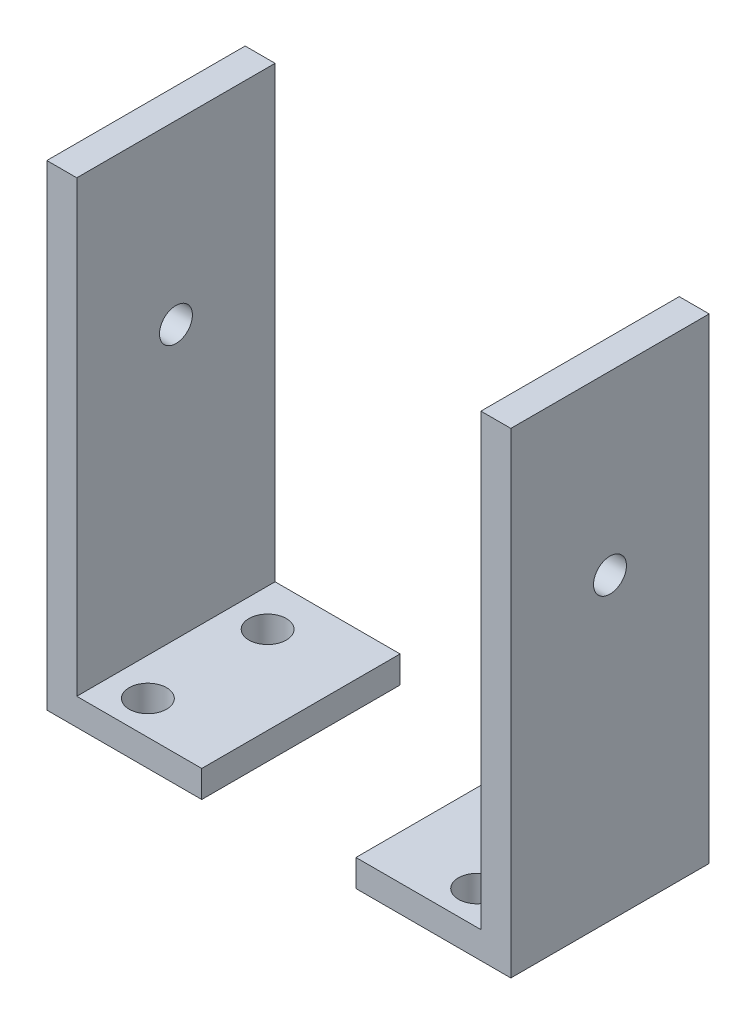
from build123d import *

# Parameters (mm, degrees)
SKETCH1_W             = 31
SKETCH1_H             = 13.25
SKETCH1_R             = 1.25
BOSS_EXTRUDE1_DEPTH   = 1.8
SKETCH4_R             = 1.25
BOSS_EXTRUDE2_DEPTH   = 5
BOSS_EXTRUDE2_2_DEPTH = 5
BOSS_EXTRUDE2_3_DEPTH = 5
BOSS_EXTRUDE2_4_DEPTH = 5
SKETCH4_4_R           = 1.25
BOSS_EXTRUDE4_DEPTH   = 1.8
SKETCH2_W             = 2
SKETCH2_H             = 13.25
BOSS_EXTRUDE5_DEPTH   = 30
SKETCH6_W             = 10.301582584
SKETCH6_H             = 13.25
CUT_EXTRUDE1_DEPTH    = 1.8
CUT_EXTRUDE2_START    = -31
SKETCH7_R             = 1.1
CUT_EXTRUDE2_DEPTH    = 31
SKETCH4_5_R           = 1.25
CUT_EXTRUDE3_DEPTH    = 10


with BuildPart() as part:
    # Sketch1 → Boss-Extrude1 (new body)
    with BuildSketch(Plane(origin=(0, 0, 0), x_dir=(1, 0, 0), z_dir=(0, 1, 0))):
        with Locations((15.5, 6.625)):
            Rectangle(SKETCH1_W, SKETCH1_H)
        with Locations(Location((4.5, 2.25, 0), (0, 0, 270))):
            Circle(SKETCH1_R, mode=Mode.SUBTRACT)
        with Locations(Location((26.5, 2.25, 0), (0, 0, 270))):
            Circle(SKETCH1_R, mode=Mode.SUBTRACT)
        with Locations(Location((26.5, 10.25, 0), (0, 0, 90))):
            Circle(SKETCH1_R, mode=Mode.SUBTRACT)
        with Locations(Location((4.5, 10.25, 0), (0, 0, 90))):
            Circle(SKETCH1_R, mode=Mode.SUBTRACT)
    extrude(amount=BOSS_EXTRUDE1_DEPTH)



with BuildPart() as body_2:
    # Sketch4 → Boss-Extrude2 (new body)
    with BuildSketch(Plane.XZ):
        with Locations(Location((4.5, -2.25, 0), (0, 0, 90))):
            Circle(SKETCH4_R)
    extrude(amount=BOSS_EXTRUDE2_DEPTH)


with BuildPart() as body_3:
    # Sketch4 → Boss-Extrude2 2 (new body)
    with BuildSketch(Plane.XZ):
        with Locations(Location((26.5, -2.25, 0), (0, 0, 90))):
            Circle(SKETCH4_R)
    extrude(amount=BOSS_EXTRUDE2_2_DEPTH)


with BuildPart() as body_4:
    # Sketch4 → Boss-Extrude2 3 (new body)
    with BuildSketch(Plane.XZ):
        with Locations(Location((26.5, -10.25, 0), (0, 0, 270))):
            Circle(SKETCH4_R)
    extrude(amount=BOSS_EXTRUDE2_3_DEPTH)


with BuildPart() as body_5:
    # Sketch4 → Boss-Extrude2 4 (new body)
    with BuildSketch(Plane.XZ):
        with Locations(Location((4.5, -10.25, 0), (0, 0, 270))):
            Circle(SKETCH4_R)
    extrude(amount=BOSS_EXTRUDE2_4_DEPTH)


with BuildPart() as part_1:
    add(part.part)

    add(body_2.part)  # Boss-Extrude4 merges body 2

    add(body_3.part)  # Boss-Extrude4 merges body 3

    add(body_4.part)  # Boss-Extrude4 merges body 4

    add(body_5.part)  # Boss-Extrude4 merges body 5
    # Sketch4<4> → Boss-Extrude4 (add)
    with BuildSketch(Plane.XZ):
        with Locations(Location((4.5, -2.25, 0), (0, 0, 270))):
            Circle(SKETCH4_4_R)
        with Locations(Location((26.5, -2.25, 0), (0, 0, 270))):
            Circle(SKETCH4_4_R)
        with Locations(Location((26.5, -10.25, 0), (0, 0, 270))):
            Circle(SKETCH4_4_R)
        with Locations(Location((4.5, -10.25, 0), (0, 0, 270))):
            Circle(SKETCH4_4_R)
    extrude(amount=-BOSS_EXTRUDE4_DEPTH)

    # Sketch2 → Boss-Extrude5 (add)
    with BuildSketch(Plane(origin=(0, 1.8, 0), x_dir=(1, 0, 0), z_dir=(0, 1, 0))):
        with Locations((1, 6.625)):
            Rectangle(SKETCH2_W, SKETCH2_H)
        with Locations((30, 6.625)):
            Rectangle(SKETCH2_W, SKETCH2_H)
    extrude(amount=BOSS_EXTRUDE5_DEPTH)

    # Sketch6 → Cut-Extrude1 (cut)
    with BuildSketch(Plane(origin=(0, 1.8, 0), x_dir=(1, 0, 0), z_dir=(0, 1, 0))):
        with Locations((15.5, 6.625)):
            Rectangle(SKETCH6_W, SKETCH6_H)
    extrude(amount=-CUT_EXTRUDE1_DEPTH, mode=Mode.SUBTRACT)


with BuildPart() as cut_extrude1_piece_1:
    # of the separate pieces the step leaves, piece 1, a body of its own (cut_extrude1_pieces)
    add(part_1.part.solids().sort_by_distance((0, 31.8, 0))[0])


with BuildPart() as cut_extrude1_piece_2:
    # of the separate pieces the step leaves, piece 2, a body of its own (cut_extrude1_pieces)
    add(part_1.part.solids().sort_by_distance((20.650791292, 0, 0))[0])


with BuildPart() as cut_extrude2_tool:
    # Sketch7 → Cut-Extrude2 (new body)
    with BuildSketch(Plane(origin=(31, 0, 0), x_dir=(0, 0, -1), z_dir=(1, 0, 0)).offset(CUT_EXTRUDE2_START)):
        with Locations((6.625, 20)):
            Circle(SKETCH7_R)
    extrude(amount=CUT_EXTRUDE2_DEPTH)


with BuildPart() as cut_extrude1_piece_1_1:
    add(cut_extrude1_piece_1.part)

    # Cut-Extrude2: cut by cut_extrude2_tool
    add(cut_extrude2_tool.part, mode=Mode.SUBTRACT)


with BuildPart() as cut_extrude1_piece_2_1:
    add(cut_extrude1_piece_2.part)

    # Cut-Extrude2: cut by cut_extrude2_tool
    add(cut_extrude2_tool.part, mode=Mode.SUBTRACT)


with BuildPart() as cut_extrude3_tool:
    # Sketch4<5> → Cut-Extrude3 (new body)
    with BuildSketch(Plane.XZ):
        with Locations(Location((4.5, -2.25, 0), (0, 0, 270))):
            Circle(SKETCH4_5_R)
        with Locations(Location((26.5, -2.25, 0), (0, 0, 270))):
            Circle(SKETCH4_5_R)
        with Locations(Location((26.5, -10.25, 0), (0, 0, 270))):
            Circle(SKETCH4_5_R)
        with Locations(Location((4.5, -10.25, 0), (0, 0, 270))):
            Circle(SKETCH4_5_R)
    extrude(amount=-CUT_EXTRUDE3_DEPTH)


with BuildPart() as cut_extrude1_piece_1_2:
    add(cut_extrude1_piece_1_1.part)

    # Cut-Extrude3: cut by cut_extrude3_tool
    add(cut_extrude3_tool.part, mode=Mode.SUBTRACT)


with BuildPart() as cut_extrude1_piece_2_2:
    add(cut_extrude1_piece_2_1.part)

    # Cut-Extrude3: cut by cut_extrude3_tool
    add(cut_extrude3_tool.part, mode=Mode.SUBTRACT)


with BuildPart() as cut_extrude3_piece_1:
    # of the separate pieces the step leaves, piece 1, a body of its own (cut_extrude3_pieces)
    add(cut_extrude1_piece_1_2.part.solids().sort_by_distance((0, 31.8, 0))[0])


with BuildPart() as cut_extrude3_piece_2:
    # of the separate pieces the step leaves, piece 2, a body of its own (cut_extrude3_pieces)
    add(cut_extrude1_piece_1_2.part.solids().sort_by_distance((4.5, -5, -11.5))[0])


with BuildPart() as cut_extrude3_piece_3:
    # of the separate pieces the step leaves, piece 3, a body of its own (cut_extrude3_pieces)
    add(cut_extrude1_piece_1_2.part.solids().sort_by_distance((4.5, -5, -1))[0])


with BuildPart() as cut_extrude3_piece_1_of_cut_extrude1_pie:
    # of the separate pieces the step leaves, piece 1, a body of its own (cut_extrude3_pieces_of_cut_extrude1_piec)
    add(cut_extrude1_piece_2_2.part.solids().sort_by_distance((20.650791292, 0, 0))[0])


with BuildPart() as cut_extrude3_piece_2_of_cut_extrude1_pie:
    # of the separate pieces the step leaves, piece 2, a body of its own (cut_extrude3_pieces_of_cut_extrude1_piec)
    add(cut_extrude1_piece_2_2.part.solids().sort_by_distance((26.5, -5, -11.5))[0])


with BuildPart() as cut_extrude3_piece_3_of_cut_extrude1_pie:
    # of the separate pieces the step leaves, piece 3, a body of its own (cut_extrude3_pieces_of_cut_extrude1_piec)
    add(cut_extrude1_piece_2_2.part.solids().sort_by_distance((26.5, -5, -1))[0])


solid = Compound([cut_extrude3_piece_1.part, cut_extrude3_piece_1_of_cut_extrude1_pie.part])
